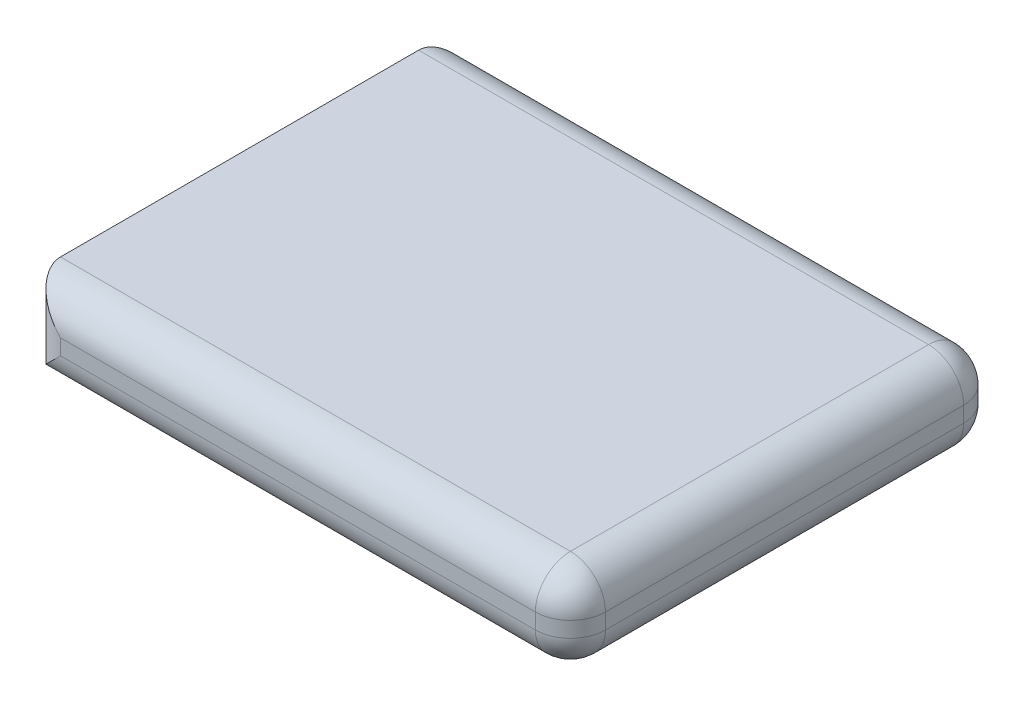
from build123d import *

# Parameters (mm, degrees)
SKETCH1_W           = 70
SKETCH1_H           = 55
BOSS_EXTRUDE1_DEPTH = 5.5
FILLET1_R           = 4.5


with BuildPart() as part:
    # Sketch1 → Boss-Extrude1 (new, symmetric)
    with BuildSketch(Plane(origin=(0, 0, 0), x_dir=(1, 0, 0), z_dir=(0, 1, 0))):
        Rectangle(SKETCH1_W, SKETCH1_H)
    extrude(amount=BOSS_EXTRUDE1_DEPTH, both=True)

    # Fillet1
    fillet1_edges = [part.edges().sort_by_distance(p)[0] for p in [
        (0, 5.5, 27.5),
        (35, 5.5, 0),
        (0, -5.5, 27.5),
        (0, -5.5, -27.5),
        (35, -5.5, 0),
        (35, 0, 27.5),
        (-35, 0, 27.5),
        (-35, 0, -27.5),
        (35, 0, -27.5),
        (0, 5.5, -27.5),
    ]]
    fillet(fillet1_edges, radius=FILLET1_R)


solid = part.part
